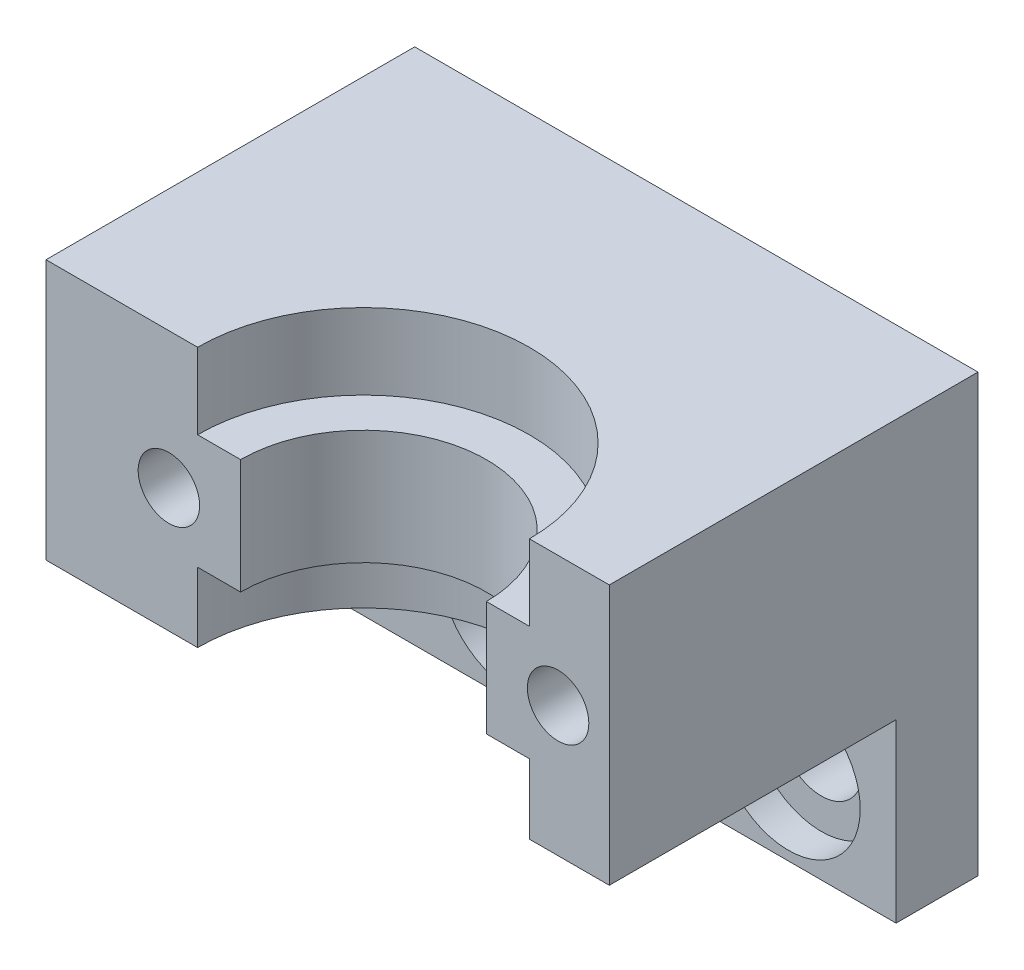
from build123d import *

# Parameters (mm, degrees)
SKETCH1_W           = 24
SKETCH1_H           = 12.7
SKETCH1_R           = 1.5
BOSS_EXTRUDE1_DEPTH = 18
SKETCH3_R           = 6
CUT_EXTRUDE1_DEPTH  = 15
SKETCH4_R           = 8.1
CUT_EXTRUDE2_DEPTH  = 3.7
CUT_EXTRUDE3_START  = -3.4
SKETCH5_R           = 8.1
CUT_EXTRUDE3_DEPTH  = 3.4
SKETCH6_W           = 24
SKETCH6_H           = 4
BOSS_EXTRUDE2_DEPTH = 8.6
SKETCH7_R           = 2
CUT_EXTRUDE4_DEPTH  = 8.6
SKETCH8_R           = 3.5
CUT_EXTRUDE5_DEPTH  = 1.6
BOSS_EXTRUDE3_DEPTH = 3.5


with BuildPart() as part:
    # Sketch1 → Boss-Extrude1 (new body)
    with BuildSketch(Plane.XY):
        with Locations((-12, 6.35)):
            Rectangle(SKETCH1_W, SKETCH1_H)
        with Locations((-21.5, 6.05)):
            Circle(SKETCH1_R, mode=Mode.SUBTRACT)
        with Locations((-2.5, 6.35)):
            Circle(SKETCH1_R, mode=Mode.SUBTRACT)
    extrude(amount=BOSS_EXTRUDE1_DEPTH)

    # Sketch3 → Cut-Extrude1 (cut)
    with BuildSketch(Plane(origin=(0, 12.7, 0), x_dir=(1, 0, 0), z_dir=(0, 1, 0))):
        with Locations((-12, -18)):
            Circle(SKETCH3_R)
    extrude(amount=-CUT_EXTRUDE1_DEPTH, mode=Mode.SUBTRACT)

    # Sketch4 → Cut-Extrude2 (cut)
    with BuildSketch(Plane(origin=(0, 12.7, 0), x_dir=(1, 0, 0), z_dir=(0, 1, 0))):
        with Locations((-12, -18)):
            Circle(SKETCH4_R)
    extrude(amount=-CUT_EXTRUDE2_DEPTH, mode=Mode.SUBTRACT)

    # Sketch5 → Cut-Extrude3 (cut)
    with BuildSketch(Plane.XZ.offset(CUT_EXTRUDE3_START)):
        with Locations((-12, 18)):
            Circle(SKETCH5_R)
    extrude(amount=CUT_EXTRUDE3_DEPTH, mode=Mode.SUBTRACT)

    # Sketch6 → Boss-Extrude2 (add)
    with BuildSketch(Plane.XZ):
        with Locations((-12, 2)):
            Rectangle(SKETCH6_W, SKETCH6_H)
    extrude(amount=BOSS_EXTRUDE2_DEPTH)

    # Sketch7 → Cut-Extrude4 (cut)
    with BuildSketch(Plane.XY.offset(4)):
        with Locations((-18.75, -4.65)):
            Circle(SKETCH7_R)
        with Locations((-5.25, -4.65)):
            Circle(SKETCH7_R)
    extrude(amount=-CUT_EXTRUDE4_DEPTH, mode=Mode.SUBTRACT)

    # Sketch8 → Cut-Extrude5 (cut)
    with BuildSketch(Plane.XY.offset(4)):
        with Locations((-18.75, -4.65)):
            Circle(SKETCH8_R)
        with Locations((-5.25, -4.65)):
            Circle(SKETCH8_R)
    extrude(amount=-CUT_EXTRUDE5_DEPTH, mode=Mode.SUBTRACT)

    # Sketch9 → Boss-Extrude3 (add)
    with BuildSketch(Plane.ZY.offset(24)):
        Polygon((0, 12.7), (0, -8.6), (4, -8.6), (4, 0), (18, 0), (18, 12.7), align=None)
    extrude(amount=BOSS_EXTRUDE3_DEPTH)


solid = part.part
